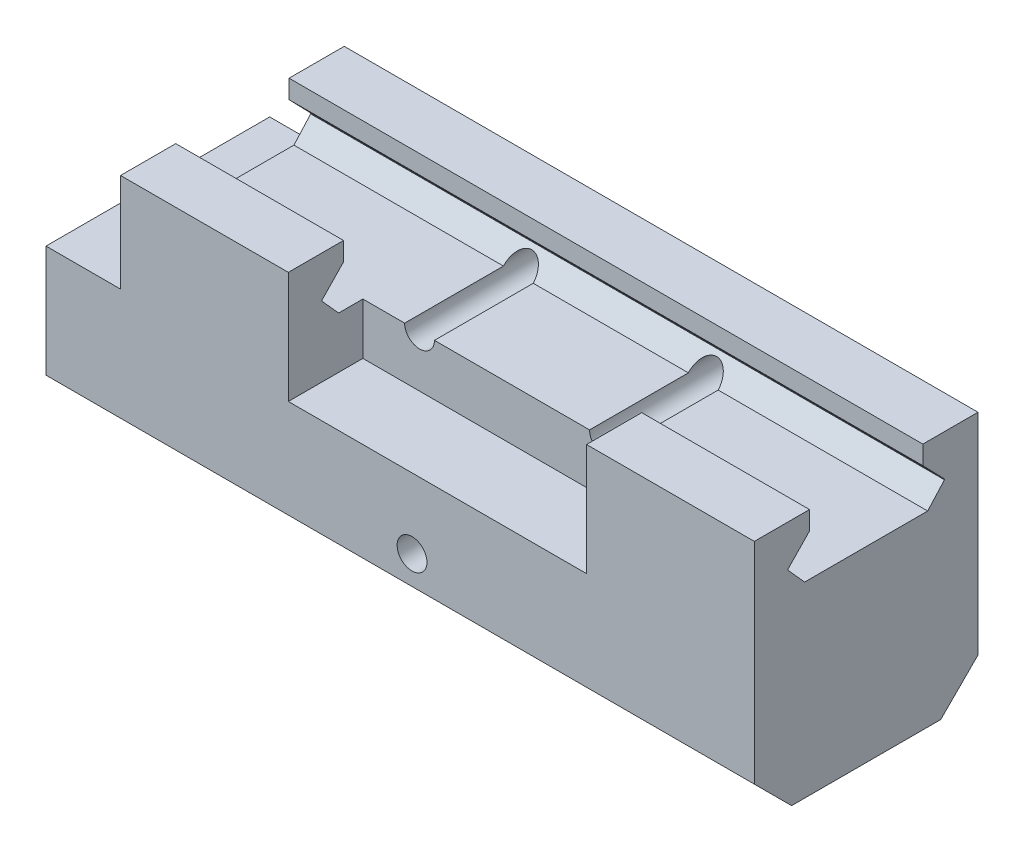
from build123d import *

# Parameters (mm, degrees)
SKETCH_1_W               = 30
SKETCH_1_H               = 20
SKETCH_1_W_2             = 12
SKETCH_1_H_2             = 10
EXTRUDE_1_DEPTH          = 10
CUT_EXTRUDE_1_DEPTH      = 3
SKETCH_4_R               = 1.95
CUT_EXTRUDE_2_DEPTH      = 30
SKETCH_8_R               = 2.8
SKETCH_8_R_2             = 2.2
CUT_EXTRUDE_3_DEPTH      = 5
FILLET_1_R               = 1
SKETCH_12_W              = 85
SKETCH_12_H              = 33.2
EXTRUDE_3_DEPTH          = 15
CUT_EXTRUDE_4_DEPTH      = 100
CHAMFER_1_SIZE           = 5
CUT_EXTRUDE_5_DEPTH      = 99.935534567
CUT_EXTRUDE_5_DEPTH_BACK = 99.935534567
SKETCH_14_R              = 2
CUT_EXTRUDE_6_DEPTH      = 7.5
CUT_EXTRUDE_7_DEPTH      = 99.935534567
CUT_EXTRUDE_7_DEPTH_BACK = 99.935534567
SKETCH_16_R              = 2
SKETCH_17_W              = 40
SKETCH_17_H              = 15
CUT_EXTRUDE_8_DEPTH      = 10


with BuildPart() as part:
    # 스케치1 → 보스-돌출1 (new body)
    with BuildSketch(Plane(origin=(0, 0, 0), x_dir=(0, 0, -1), z_dir=(1, 0, 0))):
        Rectangle(SKETCH_1_W, SKETCH_1_H)
        Rectangle(SKETCH_1_W_2, SKETCH_1_H_2, mode=Mode.SUBTRACT)
    extrude(amount=EXTRUDE_1_DEPTH)

    # 스케치2 → 컷-돌출1 (cut)
    with BuildSketch(Plane(origin=(0, 0, -15), x_dir=(-1, 0, 0), z_dir=(0, 0, -1))):
        Polygon((-1.175, -2.006292185), (-1.175, 2.006292185), (-4.65, 4.012584371), (-8.125, 2.006292185), (-8.125, -2.006292185), (-4.65, -4.012584371), align=None)
    extrude(amount=-CUT_EXTRUDE_1_DEPTH, mode=Mode.SUBTRACT)

    # 스케치4 → 컷-돌출2 (cut)
    with BuildSketch(Plane.XY):
        with Locations(Location((4.65, 0, 0), (0, 0, 270))):
            Circle(SKETCH_4_R)
    extrude(amount=-CUT_EXTRUDE_2_DEPTH, mode=Mode.SUBTRACT)

    # 스케치8 → 컷-돌출3 (cut)
    with BuildSketch(Plane(origin=(0, 0, 6), x_dir=(-1, 0, 0), z_dir=(0, 0, -1))):
        with Locations(Location((-4.65, 0, 0), (0, 0, 90))):
            Circle(SKETCH_8_R)
        with Locations(Location((-4.65, 0, 0), (0, 0, 90))):
            Circle(SKETCH_8_R_2, mode=Mode.SUBTRACT)
    extrude(amount=-CUT_EXTRUDE_3_DEPTH, mode=Mode.SUBTRACT)

    # 필렛1
    fillet_1_edges = [part.edges().sort_by_distance(p)[0] for p in [
        (4.65, -2.2, 6),
    ]]
    fillet(fillet_1_edges, radius=FILLET_1_R)

    # 스케치12 → 보스-돌출3 (add, symmetric)
    with BuildSketch(Plane.XY):
        with Locations((52.5, 6.6)):
            Rectangle(SKETCH_12_W, SKETCH_12_H)
    extrude(amount=EXTRUDE_3_DEPTH, both=True)

    # 스케치13 → 컷-돌출4 (cut, symmetric)
    with BuildSketch(Plane(origin=(0, 0, 0), x_dir=(0, 0, -1), z_dir=(1, 0, 0))):
        Polygon((7.6, 23.2), (-7.6, 23.2), (-7.6, 20.7), (-10.5, 17.7), (-10.5, 17.6), (-8.25, 15.1), (8.25, 15.1), (10.5, 17.6), (10.5, 17.7), (7.6, 20.7), align=None)
    extrude(amount=CUT_EXTRUDE_4_DEPTH, both=True, mode=Mode.SUBTRACT)

    # 모따기1
    chamfer_1_edges = [part.edges().sort_by_distance(p)[0] for p in [
        (47.5, -10, -15),
        (47.5, -10, 15),
    ]]
    chamfer(chamfer_1_edges, length=CHAMFER_1_SIZE)

    # 스케치14 → 컷-돌출5 (cut, two sides: drawn at the far end of the back side and taken through both)
    with BuildSketch(Plane.XY.offset(-CUT_EXTRUDE_5_DEPTH_BACK)):
        with Locations(Location((40.1, 15.1, 0), (0, 0, 90))):
            Circle(SKETCH_14_R)
        with Locations(Location((64.9, 15.1, 0), (0, 0, 90))):
            Circle(SKETCH_14_R)
    extrude(amount=CUT_EXTRUDE_5_DEPTH + CUT_EXTRUDE_5_DEPTH_BACK, mode=Mode.SUBTRACT)

    # 스케치15 → 컷-돌출6 (cut, symmetric)
    with BuildSketch(Plane.XY):
        with BuildLine():
            Line((62.713186115, 5.72501597), (49.092705045, 5.72501597))
            ThreePointArc((49.092705045, 5.72501597), (44.199467341, 3.698170549), (42.17262192, -1.195067155))
            Line((42.17262192, -1.195067155), (42.17262192, -12.628733774))
            Line((42.17262192, -12.628733774), (87.317926114, -12.628733774))
            Line((87.317926114, -12.628733774), (87.317926114, -10))
            Line((87.317926114, -10), (62.713186115, 5.72501597))
        make_face()
    extrude(amount=CUT_EXTRUDE_6_DEPTH, both=True, mode=Mode.SUBTRACT)

    # 스케치16 → 컷-돌출7 (cut, two sides: drawn at the far end of the back side and taken through both)
    with BuildSketch(Plane.XY.offset(-CUT_EXTRUDE_7_DEPTH_BACK)):
        with Locations((49.092705045, -1.195067155)):
            Circle(SKETCH_16_R)
    extrude(amount=CUT_EXTRUDE_7_DEPTH + CUT_EXTRUDE_7_DEPTH_BACK, mode=Mode.SUBTRACT)

    # 스케치17 → 컷-돌출8 (cut)
    with BuildSketch(Plane.XY.offset(15)):
        with Locations((52.5, 15.7)):
            Rectangle(SKETCH_17_W, SKETCH_17_H)
    extrude(amount=-CUT_EXTRUDE_8_DEPTH, mode=Mode.SUBTRACT)


solid = part.part
